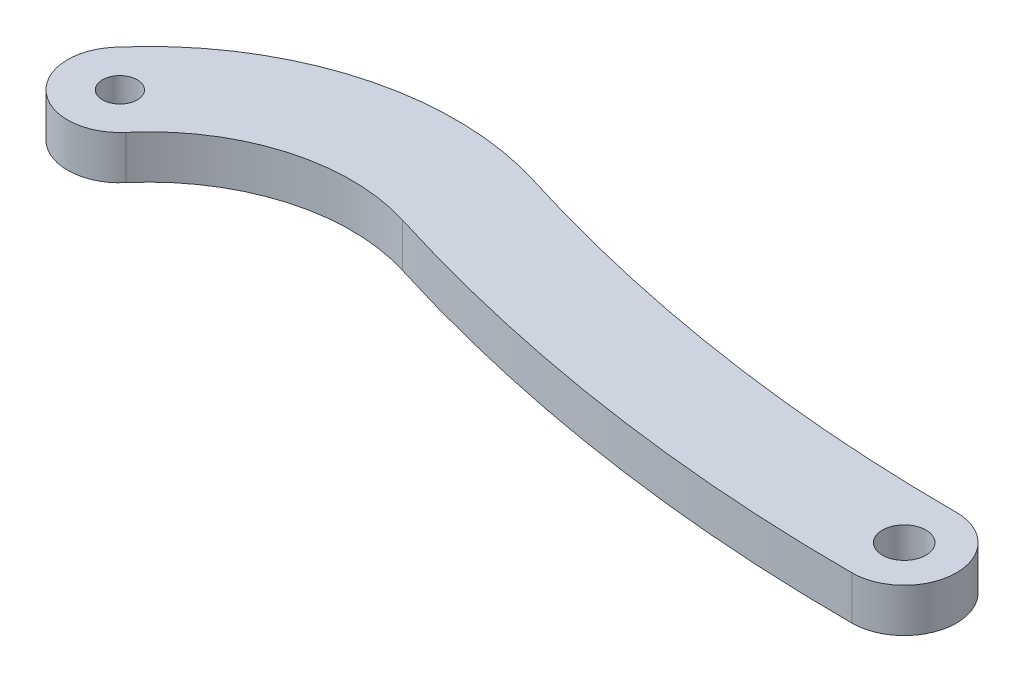
from build123d import *

# Parameters (mm, degrees)
SKETCH1_R           = 2.54
SKETCH1_R_2         = 3.175
BOSS_EXTRUDE1_DEPTH = 6.35


with BuildPart() as part:
    # Sketch1 → Boss-Extrude1 (new body)
    with BuildSketch(Plane(origin=(0, 0, 0), x_dir=(1, 0, 0), z_dir=(0, 1, 0))):
        with BuildLine():
            ThreePointArc((5.809594947, -4.930822097), (-4.930822097, -5.809594947), (-5.809594947, 4.930822097))
            ThreePointArc((-5.809594947, 4.930822097), (15.83151286, 18.946305392), (41.613397719, 18.689922307))
            ThreePointArc((41.613397719, 18.689922307), (77.537637008, 10.403344539), (114.3, 7.62))
            ThreePointArc((114.3, 7.62), (121.92, 0), (114.3, -7.62))
            ThreePointArc((114.3, -7.62), (75.243094408, -4.662931519), (37.076624458, 4.140857444))
            ThreePointArc((37.076624458, 4.140857444), (20.078056688, 4.309896491), (5.809594947, -4.930822097))
        make_face()
        with Locations(Location((0, 0, 0), (0, 0, 270))):
            Circle(SKETCH1_R, mode=Mode.SUBTRACT)
        with Locations(Location((114.3, 0, 0), (0, 0, 270))):
            Circle(SKETCH1_R_2, mode=Mode.SUBTRACT)
    extrude(amount=BOSS_EXTRUDE1_DEPTH)


solid = part.part
